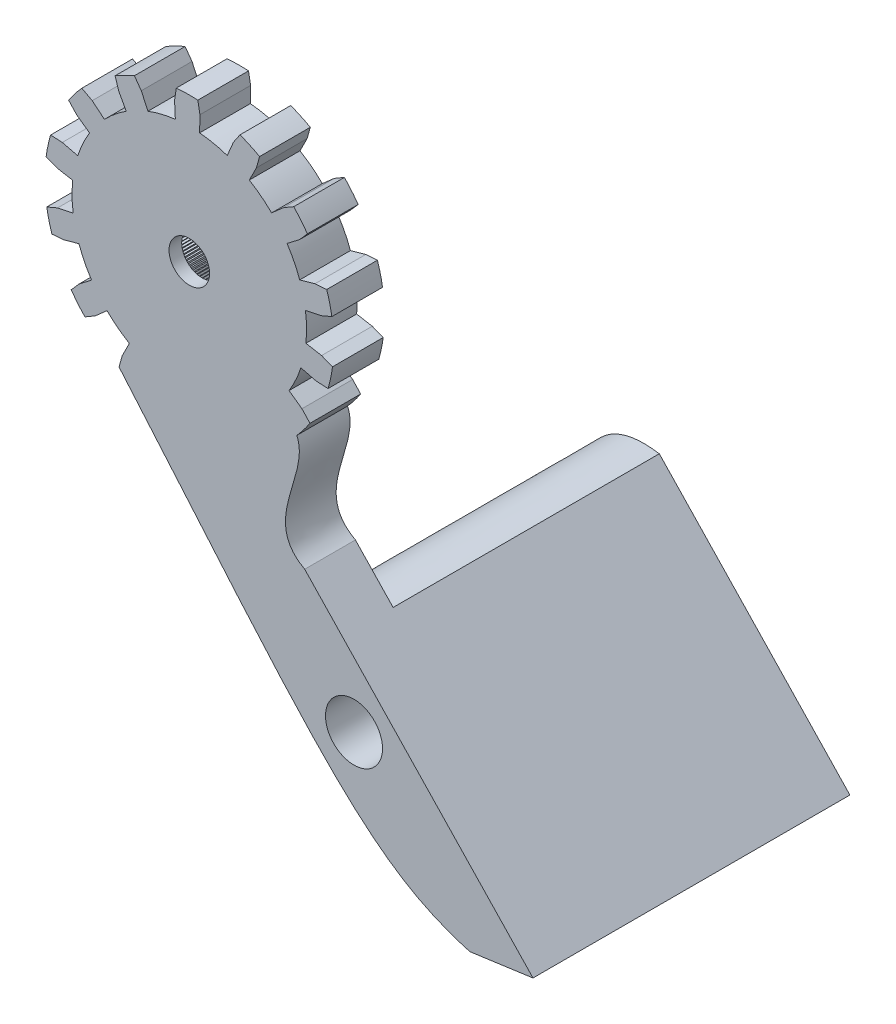
from build123d import *

# Parameters (mm, degrees)
BOSS_EXTRUDE1_DEPTH = 4
SKETCH3_R           = 3.5
BOSS_EXTRUDE2_DEPTH = 1
BOSS_EXTRUDE3_DEPTH = 4
BOSS_EXTRUDE4_DEPTH = 21
CUT_EXTRUDE1_DEPTH  = 3
SKETCH8_R           = 1.6
CUT_EXTRUDE2_DEPTH  = 8
SKETCH9_R           = 2.25
CUT_EXTRUDE3_DEPTH  = 58.805573726
SKETCH10_R          = 4
BOSS_EXTRUDE5_DEPTH = 1


with BuildPart() as part:
    # Sketch2 → Boss-Extrude1 (new body)
    with BuildSketch(Plane.XY):
        with BuildLine():
            Line((17.68781088, 7.309984121), (18.627860573, 8.138033693))
            Line((18.627860573, 8.138033693), (19.430379653, 8.604441903))
            ThreePointArc((19.430379653, 8.604441903), (19.995203762, 7.96839095), (20.511027992, 7.291994282))
            Line((20.511027992, 7.291994282), (19.899268666, 6.593908315))
            Line((19.899268666, 6.593908315), (18.906195626, 5.830255607))
            ThreePointArc((18.906195626, 5.830255607), (19.464749307, 4.865356726), (19.903157697, 3.840266414))
            Line((19.903157697, 3.840266414), (21.109390449, 4.178441024))
            Line((21.109390449, 4.178441024), (22.034802094, 4.250460322))
            ThreePointArc((22.034802094, 4.250460322), (22.267718866, 3.432330219), (22.438982924, 2.599110133))
            Line((22.438982924, 2.599110133), (21.584918666, 2.235588834))
            Line((21.584918666, 2.235588834), (20.358854282, 1.978439762))
            ThreePointArc((20.358854282, 1.978439762), (20.443439825, 0.86674855), (20.393662118, -0.24704418))
            Line((20.393662118, -0.24704418), (21.62716874, -0.465724161))
            Line((21.62716874, -0.465724161), (22.492183824, -0.80235808))
            ThreePointArc((22.492183824, -0.80235808), (22.347061236, -1.640526633), (22.139844174, -2.465540681))
            Line((22.139844174, -2.465540681), (21.212632886, -2.42249746))
            Line((21.212632886, -2.42249746), (19.996414245, -2.12221137))
            ThreePointArc((19.996414245, -2.12221137), (19.590278446, -3.160510834), (19.062173728, -4.142405671))
            Line((19.062173728, -4.142405671), (20.078643104, -4.874627991))
            Line((20.078643104, -4.874627991), (20.711934781, -5.553240651))
            ThreePointArc((20.711934781, -5.553240651), (20.217516142, -6.245438093), (19.672859841, -6.898841951))
            Line((19.672859841, -6.898841951), (18.85614709, -6.457759449))
            Line((18.85614709, -6.457759449), (17.89066121, -5.659513538))
            ThreePointArc((17.89066121, -5.659513538), (17.074244245, -6.418773312), (16.172410131, -7.074293942))
            Line((16.172410131, -7.074293942), (16.770518037, -8.175032991))
            Line((16.770518037, -8.175032991), (17.046655123, -9.061216832))
            ThreePointArc((17.046655123, -9.061216832), (16.300866108, -9.470344969), (15.526646427, -9.822723991))
            Line((15.526646427, -9.822723991), (14.98219219, -9.070964007))
            Line((14.98219219, -9.070964007), (14.45866539, -7.932860668))
            ThreePointArc((14.45866539, -7.932860668), (13.393668651, -8.262700042), (12.296724449, -8.462012564))
            Line((12.296724449, -8.462012564), (12.358008277, -9.713253473))
            Line((12.358008277, -9.713253473), (12.222298437, -10.631488917))
            ThreePointArc((12.222298437, -10.631488917), (11.372851706, -10.676514905), (10.52241235, -10.658076103))
            Line((10.52241235, -10.658076103), (10.358052465, -9.744533921))
            Line((10.358052465, -9.744533921), (10.380175648, -8.491988479))
            ThreePointArc((10.380175648, -8.491988479), (9.277534802, -8.327078719), (8.202743763, -8.030706845))
            Line((8.202743763, -8.030706845), (7.7150655, -9.184626007))
            Line((7.7150655, -9.184626007), (7.194387732, -9.953045262))
            ThreePointArc((7.194387732, -9.953045262), (6.409526628, -9.625051151), (5.65130754, -9.239446557))
            Line((5.65130754, -9.239446557), (5.899595498, -8.34506041))
            Line((5.899595498, -8.34506041), (6.462986898, -7.226154851))
            ThreePointArc((6.462986898, -7.226154851), (5.541093486, -6.599158358), (4.701331158, -5.865802171))
            Line((4.701331158, -5.865802171), (3.761281465, -6.693851744))
            Line((3.761281465, -6.693851744), (2.958762386, -7.160259953))
            ThreePointArc((2.958762386, -7.160259953), (2.393938277, -6.524209001), (1.878114046, -5.847812333))
            Line((1.878114046, -5.847812333), (2.489873373, -5.149726366))
            Line((2.489873373, -5.149726366), (3.482946412, -4.386073658))
            ThreePointArc((3.482946412, -4.386073658), (2.924392731, -3.421174777), (2.485984341, -2.396084465))
            Line((2.485984341, -2.396084465), (1.279751589, -2.734259075))
            Line((1.279751589, -2.734259075), (0.354339945, -2.806278373))
            ThreePointArc((0.354339945, -2.806278373), (0.121423172, -1.98814827), (-0.049840885, -1.154928184))
            Line((-0.049840885, -1.154928184), (0.804223372, -0.791406885))
            Line((0.804223372, -0.791406885), (2.030287756, -0.534257812))
            ThreePointArc((2.030287756, -0.534257812), (1.945702213, 0.577433399), (1.99547992, 1.691226129))
            Line((1.99547992, 1.691226129), (0.761973298, 1.90990611))
            Line((0.761973298, 1.90990611), (-0.103041785, 2.24654003))
            ThreePointArc((-0.103041785, 2.24654003), (0.042080802, 3.084708583), (0.249297864, 3.90972263))
            Line((0.249297864, 3.90972263), (1.176509152, 3.86667941))
            Line((1.176509152, 3.86667941), (2.392727793, 3.566393319))
            ThreePointArc((2.392727793, 3.566393319), (2.798863592, 4.604692783), (3.32696831, 5.58658762))
            Line((3.32696831, 5.58658762), (2.310498934, 6.31880994))
            Line((2.310498934, 6.31880994), (1.677207257, 6.9974226))
            ThreePointArc((1.677207257, 6.9974226), (2.171625896, 7.689620042), (2.716282197, 8.3430239))
            Line((2.716282197, 8.3430239), (3.532994948, 7.901941399))
            Line((3.532994948, 7.901941399), (4.498480829, 7.103695488))
            ThreePointArc((4.498480829, 7.103695488), (5.314897794, 7.862955261), (6.216731907, 8.518475892))
            Line((6.216731907, 8.518475892), (5.618624002, 9.61921494))
            Line((5.618624002, 9.61921494), (5.342486915, 10.505398781))
            ThreePointArc((5.342486915, 10.505398781), (6.088275931, 10.914526918), (6.862495611, 11.26690594))
            Line((6.862495611, 11.26690594), (7.406949848, 10.515145956))
            Line((7.406949848, 10.515145956), (7.930476649, 9.377042617))
            ThreePointArc((7.930476649, 9.377042617), (8.995473387, 9.706881991), (10.092417589, 9.906194514))
            Line((10.092417589, 9.906194514), (10.031133761, 11.157435422))
            Line((10.031133761, 11.157435422), (10.166843601, 12.075670866))
            ThreePointArc((10.166843601, 12.075670866), (11.016290332, 12.120696854), (11.866729689, 12.102258053))
            Line((11.866729689, 12.102258053), (12.031089574, 11.18871587))
            Line((12.031089574, 11.18871587), (12.00896639, 9.936170428))
            ThreePointArc((12.00896639, 9.936170428), (13.111607236, 9.771260668), (14.186398275, 9.474888794))
            Line((14.186398275, 9.474888794), (14.674076538, 10.628807956))
            Line((14.674076538, 10.628807956), (15.194754306, 11.397227211))
            ThreePointArc((15.194754306, 11.397227211), (15.97961541, 11.069233101), (16.737834498, 10.683628507))
            Line((16.737834498, 10.683628507), (16.48954654, 9.789242359))
            Line((16.48954654, 9.789242359), (15.92615514, 8.6703368))
            ThreePointArc((15.92615514, 8.6703368), (16.848048552, 8.043340307), (17.68781088, 7.309984121))
        make_face()
    extrude(amount=-BOSS_EXTRUDE1_DEPTH)

    # Sketch3 → Boss-Extrude2 (add)
    with BuildSketch(Plane.XY):
        with Locations((11.320288665, 0.73780568)):
            Circle(SKETCH3_R)
    extrude(amount=-BOSS_EXTRUDE2_DEPTH)

    # Sketch5 → Boss-Extrude3 (add)
    with BuildSketch(Plane.XY):
        with BuildLine():
            Line((20.29588635, -15.728288532), (38.306122211, -34.653200519))
            Line((38.306122211, -34.653200519), (33.333566706, -35.342967267))
            add(Edge.make_bspline(
                [(33.333566706, -35.342967267), (25.46919254, -33.153312542), (21.459050786, -27.765674192), (5.65130754, -9.239446557)],
                knots=[0.222415535, 0.222415535, 0.222415535, 0.222415535, 1, 1, 1, 1], degree=3))
            ThreePointArc((5.65130754, -9.239446557), (6.409526628, -9.625051151), (7.194387732, -9.953045262))
            Line((7.194387732, -9.953045262), (7.7150655, -9.184626007))
            Line((7.7150655, -9.184626007), (8.202743763, -8.030706845))
            ThreePointArc((8.202743763, -8.030706845), (9.277534802, -8.327078719), (10.380175648, -8.491988479))
            Line((10.380175648, -8.491988479), (10.358052465, -9.744533921))
            Line((10.358052465, -9.744533921), (10.52241235, -10.658076103))
            ThreePointArc((10.52241235, -10.658076103), (11.372851706, -10.676514905), (12.222298437, -10.631488917))
            Line((12.222298437, -10.631488917), (12.358008277, -9.713253473))
            Line((12.358008277, -9.713253473), (12.296724449, -8.462012564))
            ThreePointArc((12.296724449, -8.462012564), (13.393668651, -8.262700042), (14.45866539, -7.932860668))
            Line((14.45866539, -7.932860668), (14.98219219, -9.070964007))
            Line((14.98219219, -9.070964007), (15.526646427, -9.822723991))
            ThreePointArc((15.526646427, -9.822723991), (16.300866108, -9.470344969), (17.046655123, -9.061216832))
            Line((17.046655123, -9.061216832), (16.770518037, -8.175032991))
            Line((16.770518037, -8.175032991), (16.172410131, -7.074293942))
            ThreePointArc((16.172410131, -7.074293942), (17.074244245, -6.418773312), (17.89066121, -5.659513538))
            Line((17.89066121, -5.659513538), (18.85614709, -6.457759449))
            Line((18.85614709, -6.457759449), (19.672859841, -6.898841951))
            add(Edge.make_bspline(
                [(19.672859841, -6.898841951), (20.796515302, -9.296148385), (16.693968382, -13.778066475), (20.29588635, -15.728288532)],
                knots=[0, 0, 0, 0, 1, 1, 1, 1], degree=3))
        make_face()
    extrude(amount=-BOSS_EXTRUDE3_DEPTH)

    # Sketch6 → Boss-Extrude4 (add)
    with BuildSketch(Plane(origin=(0, 0, -4), x_dir=(-1, 0, 0), z_dir=(0, 0, -1))):
        with BuildLine():
            Line((-38.306122211, -34.653200519), (-23.271090029, -18.854592274))
            add(Edge.make_bspline(
                [(-17.117154349, -22.635884617), (-18.656459063, -18.140492435), (-23.271090029, -18.854592274)],
                knots=[0, 0, 0, 1, 1, 1], degree=2))
            add(Edge.make_bspline(
                [(-17.117154349, -22.635884617), (-24.212570834, -30.710913569), (-27.828926494, -33.810326373), (-33.333566706, -35.342967267)],
                knots=[0.45573257, 0.45573257, 0.45573257, 0.45573257, 1, 1, 1, 1], degree=3))
            Line((-33.333566706, -35.342967267), (-38.306122211, -34.653200519))
        make_face()
    extrude(amount=BOSS_EXTRUDE4_DEPTH)

    # Sketch7 → Cut-Extrude1 (cut)
    with BuildSketch(Plane(origin=(0, 0, -4), x_dir=(-1, 0, 0), z_dir=(0, 0, -1))):
        Polygon((-9.784311359, 3.303827936), (-9.929710204, 3.220115618), (-9.948229206, 3.386865799), (-10.0880848, 3.294188999), (-10.117037589, 3.459447319), (-10.250797986, 3.35817179), (-10.290070299, 3.521286049), (-10.417207607, 3.41181148), (-10.466644455, 3.572137942), (-10.586656921, 3.454896378), (-10.646063198, 3.611802307), (-10.758477189, 3.487256447), (-10.827618446, 3.640122607), (-10.931990314, 3.508763977), (-11.010593682, 3.656987075), (-11.106511519, 3.519334088), (-11.194266787, 3.662329155), (-11.28135205, 3.518925064), (-11.377912888, 3.656127764), (-11.45582189, 3.507538519), (-11.560807216, 3.638407376), (-11.629232486, 3.485219391), (-11.742227971, 3.609237925), (-11.800899467, 3.452055763), (-11.921459169, 3.56873453), (-11.97014534, 3.408178517), (-12.097793466, 3.517057039), (-12.136302171, 3.353760817), (-12.270534951, 3.454409399), (-12.298714213, 3.289017424), (-12.439001892, 3.381038853), (-12.456740501, 3.21420385), (-12.602529428, 3.29723496), (-12.609757377, 3.129615352), (-12.760472189, 3.203328456), (-12.757160953, 3.03558576), (-12.912206848, 3.099689947), (-12.898369496, 2.932486167), (-13.057134578, 2.986728447), (-13.032825718, 2.82072346), (-13.194683415, 2.864889763), (-13.159998983, 2.700738715), (-13.324310516, 2.734654737), (-13.279387397, 2.573005457), (-13.445504303, 2.596537347), (-13.390519787, 2.438027791), (-13.557786478, 2.45108268), (-13.492957564, 2.296338412), (-13.660713917, 2.298864777), (-13.586296455, 2.148496504), (-13.75388041, 2.140484375), (-13.670168092, 1.99508553), (-13.836918273, 1.976566528), (-13.744241473, 1.836710934), (-13.909499793, 1.807758144), (-13.808224264, 1.673997748), (-13.971338524, 1.634725434), (-13.861863955, 1.507588127), (-14.022190417, 1.458151279), (-13.904948852, 1.338138813), (-14.061854781, 1.278732535), (-13.937308922, 1.166318545), (-14.090175082, 1.097177287), (-13.958816452, 0.99280542), (-14.10703955, 0.914202051), (-13.969386563, 0.818284214), (-14.11238163, 0.730528946), (-13.968977538, 0.643443684), (-14.106180239, 0.546882846), (-13.957590994, 0.468973844), (-14.08845985, 0.363988518), (-13.935271866, 0.295563247), (-14.059290399, 0.182567763), (-13.902108238, 0.123896267), (-14.018787004, 0.003336565), (-13.858230992, -0.045349607), (-13.967109513, -0.172997732), (-13.803813292, -0.211506437), (-13.904461874, -0.345739217), (-13.739069899, -0.373918479), (-13.831091328, -0.514206159), (-13.664256325, -0.531944767), (-13.747287435, -0.677733694), (-13.579667826, -0.684961643), (-13.653380931, -0.835676455), (-13.485638235, -0.83236522), (-13.549742422, -0.987411115), (-13.382538642, -0.973573762), (-13.436780922, -1.132338844), (-13.270775935, -1.108029984), (-13.314942238, -1.269887681), (-13.15079119, -1.23520325), (-13.184707212, -1.399514782), (-13.023057932, -1.354591663), (-13.046589822, -1.520708569), (-12.888080266, -1.465724053), (-12.901135154, -1.632990745), (-12.746390887, -1.568161831), (-12.748917252, -1.735918183), (-12.598548978, -1.661500721), (-12.59053685, -1.829084677), (-12.445138005, -1.745372359), (-12.426619002, -1.91212254), (-12.286763409, -1.81944574), (-12.257810619, -1.98470406), (-12.124050223, -1.883428531), (-12.084777909, -2.046542791), (-11.957640601, -1.937068221), (-11.908203753, -2.097394683), (-11.788191287, -1.980153119), (-11.72878501, -2.137059048), (-11.61637102, -2.012513188), (-11.547229762, -2.165379348), (-11.442857895, -2.034020718), (-11.364254526, -2.182243816), (-11.268336689, -2.044590829), (-11.180581421, -2.187585896), (-11.093496158, -2.044181805), (-10.996935321, -2.181384505), (-10.919026319, -2.03279526), (-10.814040993, -2.163664117), (-10.745615722, -2.010476132), (-10.632620237, -2.134494666), (-10.573948742, -1.977312504), (-10.453389039, -2.093991271), (-10.404702868, -1.933435258), (-10.277054742, -2.04231378), (-10.238546037, -1.879017558), (-10.104313257, -1.97966614), (-10.076133995, -1.814274165), (-9.935846316, -1.906295594), (-9.918107707, -1.739460591), (-9.77231878, -1.822491701), (-9.765090831, -1.654872093), (-9.614376019, -1.728585197), (-9.617687255, -1.560842501), (-9.46264136, -1.624946688), (-9.476478713, -1.457742908), (-9.31771363, -1.511985188), (-9.34202249, -1.345980201), (-9.180164794, -1.390146504), (-9.214849225, -1.225995456), (-9.050537692, -1.259911478), (-9.095460812, -1.098262198), (-8.929343906, -1.121794088), (-8.984328422, -0.963284532), (-8.81706173, -0.976339421), (-8.881890644, -0.821595153), (-8.714134291, -0.824121518), (-8.788551753, -0.673753245), (-8.620967798, -0.665741116), (-8.704680116, -0.520342271), (-8.537929935, -0.501823269), (-8.630606735, -0.361967675), (-8.465348415, -0.333014885), (-8.566623944, -0.199254489), (-8.403509684, -0.159982175), (-8.512984254, -0.032844868), (-8.352657792, 0.01659198), (-8.469899356, 0.136604446), (-8.312993427, 0.196010724), (-8.437539287, 0.308424714), (-8.284673127, 0.377565972), (-8.416031756, 0.481937839), (-8.267808658, 0.560541208), (-8.405461646, 0.656459045), (-8.262466579, 0.744214313), (-8.40587067, 0.831299575), (-8.26866797, 0.927860413), (-8.417257215, 1.005769415), (-8.286388358, 1.110754741), (-8.439576343, 1.179180012), (-8.315557809, 1.292175496), (-8.47273997, 1.350846992), (-8.356061204, 1.471406694), (-8.516617216, 1.520092866), (-8.407738695, 1.647740991), (-8.571034917, 1.686249696), (-8.470386334, 1.820482476), (-8.63577831, 1.848661738), (-8.543756881, 1.988949418), (-8.710591883, 2.006688026), (-8.627560773, 2.152476953), (-8.795180382, 2.159704902), (-8.721467277, 2.310419714), (-8.889209973, 2.307108479), (-8.825105786, 2.462154374), (-8.992309566, 2.448317021), (-8.938067287, 2.607082103), (-9.104072273, 2.582773243), (-9.059905971, 2.74463094), (-9.224057018, 2.709946508), (-9.190140997, 2.874258041), (-9.351790276, 2.829334922), (-9.328258386, 2.995451828), (-9.486767942, 2.940467312), (-9.473713054, 3.107734004), (-9.628457321, 3.04290509), (-9.625930956, 3.210661442), (-9.77629923, 3.13624398), align=None)
    extrude(amount=-CUT_EXTRUDE1_DEPTH, mode=Mode.SUBTRACT)

    # Sketch8 → Cut-Extrude2 (cut)
    with BuildSketch(Plane(origin=(0, 0, -4), x_dir=(-1, 0, 0), z_dir=(0, 0, -1))):
        with Locations(Location((-11.194571019, 0.722090975, 0), (0, 0, 180))):
            Circle(SKETCH8_R)
    extrude(amount=-CUT_EXTRUDE2_DEPTH, mode=Mode.SUBTRACT)

    # Sketch9 → Cut-Extrude3 (cut, through all)
    with BuildSketch(Plane.XY):
        with Locations((24.185714801, -24.918307041)):
            Circle(SKETCH9_R)
    extrude(amount=-CUT_EXTRUDE3_DEPTH, mode=Mode.SUBTRACT)

    # Sketch10 → Boss-Extrude5 (add)
    with BuildSketch(Plane(origin=(0, 0, -4), x_dir=(-1, 0, 0), z_dir=(0, 0, -1))):
        with Locations(Location((-11.194571019, 0.722090975, 0), (0, 0, 180))):
            Circle(SKETCH10_R)
        Polygon((-9.929710204, 3.220115618), (-9.948229206, 3.386865799), (-10.0880848, 3.294188999), (-10.117037589, 3.459447319), (-10.250797986, 3.35817179), (-10.290070299, 3.521286049), (-10.417207607, 3.41181148), (-10.466644455, 3.572137942), (-10.586656921, 3.454896378), (-10.646063198, 3.611802307), (-10.758477189, 3.487256447), (-10.827618446, 3.640122607), (-10.931990314, 3.508763977), (-11.010593682, 3.656987075), (-11.106511519, 3.519334088), (-11.194266787, 3.662329155), (-11.28135205, 3.518925064), (-11.377912888, 3.656127764), (-11.45582189, 3.507538519), (-11.560807216, 3.638407376), (-11.629232486, 3.485219391), (-11.742227971, 3.609237925), (-11.800899467, 3.452055763), (-11.921459169, 3.56873453), (-11.97014534, 3.408178517), (-12.097793466, 3.517057039), (-12.136302171, 3.353760817), (-12.270534951, 3.454409399), (-12.298714213, 3.289017424), (-12.439001892, 3.381038853), (-12.456740501, 3.21420385), (-12.602529428, 3.29723496), (-12.609757377, 3.129615352), (-12.760472189, 3.203328456), (-12.757160953, 3.03558576), (-12.912206848, 3.099689947), (-12.898369496, 2.932486167), (-13.057134578, 2.986728447), (-13.032825718, 2.82072346), (-13.194683415, 2.864889763), (-13.159998983, 2.700738715), (-13.324310516, 2.734654737), (-13.279387397, 2.573005457), (-13.445504303, 2.596537347), (-13.390519787, 2.438027791), (-13.557786478, 2.45108268), (-13.492957564, 2.296338412), (-13.660713917, 2.298864777), (-13.586296455, 2.148496504), (-13.75388041, 2.140484375), (-13.670168092, 1.99508553), (-13.836918273, 1.976566528), (-13.744241473, 1.836710934), (-13.909499793, 1.807758144), (-13.808224264, 1.673997748), (-13.971338524, 1.634725434), (-13.861863955, 1.507588127), (-14.022190417, 1.458151279), (-13.904948852, 1.338138813), (-14.061854781, 1.278732535), (-13.937308922, 1.166318545), (-14.090175082, 1.097177287), (-13.958816452, 0.99280542), (-14.10703955, 0.914202051), (-13.969386563, 0.818284214), (-14.11238163, 0.730528946), (-13.968977538, 0.643443684), (-14.106180239, 0.546882846), (-13.957590994, 0.468973844), (-14.08845985, 0.363988518), (-13.935271866, 0.295563247), (-14.059290399, 0.182567763), (-13.902108238, 0.123896267), (-14.018787004, 0.003336565), (-13.858230992, -0.045349607), (-13.967109513, -0.172997732), (-13.803813292, -0.211506437), (-13.904461874, -0.345739217), (-13.739069899, -0.373918479), (-13.831091328, -0.514206159), (-13.664256325, -0.531944767), (-13.747287435, -0.677733694), (-13.579667826, -0.684961643), (-13.653380931, -0.835676455), (-13.485638235, -0.83236522), (-13.549742422, -0.987411115), (-13.382538642, -0.973573762), (-13.436780922, -1.132338844), (-13.270775935, -1.108029984), (-13.314942238, -1.269887681), (-13.15079119, -1.23520325), (-13.184707212, -1.399514782), (-13.023057932, -1.354591663), (-13.046589822, -1.520708569), (-12.888080266, -1.465724053), (-12.901135154, -1.632990745), (-12.746390887, -1.568161831), (-12.748917252, -1.735918183), (-12.598548978, -1.661500721), (-12.59053685, -1.829084677), (-12.445138005, -1.745372359), (-12.426619002, -1.91212254), (-12.286763409, -1.81944574), (-12.257810619, -1.98470406), (-12.124050223, -1.883428531), (-12.084777909, -2.046542791), (-11.957640601, -1.937068221), (-11.908203753, -2.097394683), (-11.788191287, -1.980153119), (-11.72878501, -2.137059048), (-11.61637102, -2.012513188), (-11.547229762, -2.165379348), (-11.442857895, -2.034020718), (-11.364254526, -2.182243816), (-11.268336689, -2.044590829), (-11.180581421, -2.187585896), (-11.093496158, -2.044181805), (-10.996935321, -2.181384505), (-10.919026319, -2.03279526), (-10.814040993, -2.163664117), (-10.745615722, -2.010476132), (-10.632620237, -2.134494666), (-10.573948742, -1.977312504), (-10.453389039, -2.093991271), (-10.404702868, -1.933435258), (-10.277054742, -2.04231378), (-10.238546037, -1.879017558), (-10.104313257, -1.97966614), (-10.076133995, -1.814274165), (-9.935846316, -1.906295594), (-9.918107707, -1.739460591), (-9.77231878, -1.822491701), (-9.765090831, -1.654872093), (-9.614376019, -1.728585197), (-9.617687255, -1.560842501), (-9.46264136, -1.624946688), (-9.476478713, -1.457742908), (-9.31771363, -1.511985188), (-9.34202249, -1.345980201), (-9.180164794, -1.390146504), (-9.214849225, -1.225995456), (-9.050537692, -1.259911478), (-9.095460812, -1.098262198), (-8.929343906, -1.121794088), (-8.984328422, -0.963284532), (-8.81706173, -0.976339421), (-8.881890644, -0.821595153), (-8.714134291, -0.824121518), (-8.788551753, -0.673753245), (-8.620967798, -0.665741116), (-8.704680116, -0.520342271), (-8.537929935, -0.501823269), (-8.630606735, -0.361967675), (-8.465348415, -0.333014885), (-8.566623944, -0.199254489), (-8.403509684, -0.159982175), (-8.512984254, -0.032844868), (-8.352657792, 0.01659198), (-8.469899356, 0.136604446), (-8.312993427, 0.196010724), (-8.437539287, 0.308424714), (-8.284673127, 0.377565972), (-8.416031756, 0.481937839), (-8.267808658, 0.560541208), (-8.405461646, 0.656459045), (-8.262466579, 0.744214313), (-8.40587067, 0.831299575), (-8.26866797, 0.927860413), (-8.417257215, 1.005769415), (-8.286388358, 1.110754741), (-8.439576343, 1.179180012), (-8.315557809, 1.292175496), (-8.47273997, 1.350846992), (-8.356061204, 1.471406694), (-8.516617216, 1.520092866), (-8.407738695, 1.647740991), (-8.571034917, 1.686249696), (-8.470386334, 1.820482476), (-8.63577831, 1.848661738), (-8.543756881, 1.988949418), (-8.710591883, 2.006688026), (-8.627560773, 2.152476953), (-8.795180382, 2.159704902), (-8.721467277, 2.310419714), (-8.889209973, 2.307108479), (-8.825105786, 2.462154374), (-8.992309566, 2.448317021), (-8.938067287, 2.607082103), (-9.104072273, 2.582773243), (-9.059905971, 2.74463094), (-9.224057018, 2.709946508), (-9.190140997, 2.874258041), (-9.351790276, 2.829334922), (-9.328258386, 2.995451828), (-9.486767942, 2.940467312), (-9.473713054, 3.107734004), (-9.628457321, 3.04290509), (-9.625930956, 3.210661442), (-9.77629923, 3.13624398), (-9.784311359, 3.303827936), align=None, mode=Mode.SUBTRACT)
    extrude(amount=BOSS_EXTRUDE5_DEPTH)


solid = part.part
